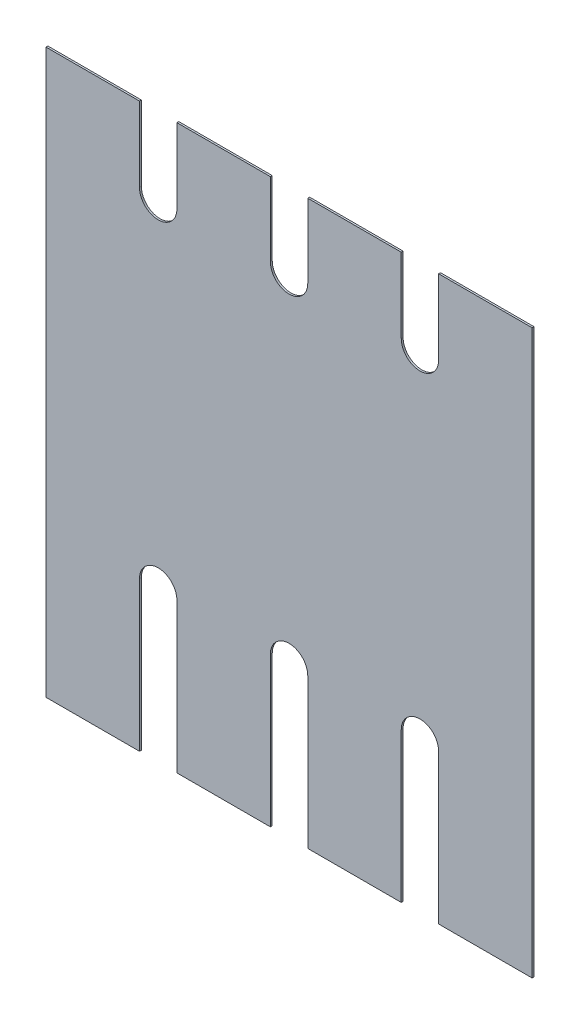
from build123d import *

# Parameters (mm, degrees)
BOSS_EXTRUDE1_DEPTH = 0.025


with BuildPart() as part:
    # Sketch3 → Boss-Extrude1 (new body)
    with BuildSketch(Plane.XY):
        with BuildLine():
            Line((-2, 3.75011651), (-3.25, 3.75011651))
            Line((-3.25, 3.75011651), (-3.25, -3.77988349))
            Line((-3.25, -3.77988349), (-2, -3.77988349))
            Line((-2, -3.77988349), (-2, -1.77988349))
            ThreePointArc((-2, -1.77988349), (-1.75, -1.52988349), (-1.5, -1.77988349))
            Line((-1.5, -1.77988349), (-1.5, -3.77988349))
            Line((-1.5, -3.77988349), (-0.25, -3.77988349))
            Line((-0.25, -3.77988349), (-0.25, -1.77988349))
            ThreePointArc((-0.25, -1.77988349), (0, -1.52988349), (0.25, -1.77988349))
            Line((0.25, -1.77988349), (0.25, -3.77988349))
            Line((0.25, -3.77988349), (1.5, -3.77988349))
            Line((1.5, -3.77988349), (1.5, -1.77988349))
            ThreePointArc((1.5, -1.77988349), (1.75, -1.52988349), (2, -1.77988349))
            Line((2, -1.77988349), (2, -3.77988349))
            Line((2, -3.77988349), (3.25, -3.77988349))
            Line((3.25, -3.77988349), (3.25, 3.75011651))
            Line((3.25, 3.75011651), (2, 3.75011651))
            Line((2, 3.75011651), (2, 2.75011651))
            ThreePointArc((2, 2.75011651), (1.75, 2.50011651), (1.5, 2.75011651))
            Line((1.5, 2.75011651), (1.5, 3.75011651))
            Line((1.5, 3.75011651), (0.25, 3.75011651))
            Line((0.25, 3.75011651), (0.25, 2.765))
            ThreePointArc((0.25, 2.765), (0, 2.515), (-0.25, 2.765))
            Line((-0.25, 2.765), (-0.25, 3.75011651))
            Line((-0.25, 3.75011651), (-1.5, 3.75011651))
            Line((-1.5, 3.75011651), (-1.5, 2.75011651))
            ThreePointArc((-1.5, 2.75011651), (-1.75, 2.50011651), (-2, 2.75011651))
            Line((-2, 2.75011651), (-2, 3.75011651))
        make_face()
    extrude(amount=BOSS_EXTRUDE1_DEPTH)


solid = part.part
